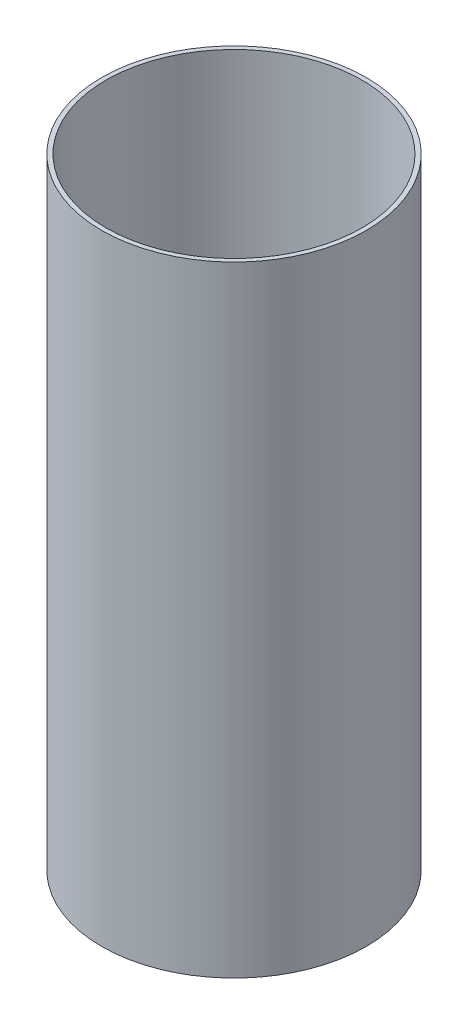
from build123d import *

# Parameters (mm, degrees)
SKETCH1_R           = 76
SKETCH1_R_2         = 73.5
BOSS_EXTRUDE1_DEPTH = 356


with BuildPart() as part:
    # Sketch1 → Boss-Extrude1 (new body)
    with BuildSketch(Plane(origin=(0, 0, 0), x_dir=(1, 0, 0), z_dir=(0, 1, 0))):
        with Locations(Location((0, 0, 0), (0, 0, 270))):
            Circle(SKETCH1_R)
        with Locations(Location((0, 0, 0), (0, 0, 270))):
            Circle(SKETCH1_R_2, mode=Mode.SUBTRACT)
    extrude(amount=BOSS_EXTRUDE1_DEPTH)


solid = part.part
